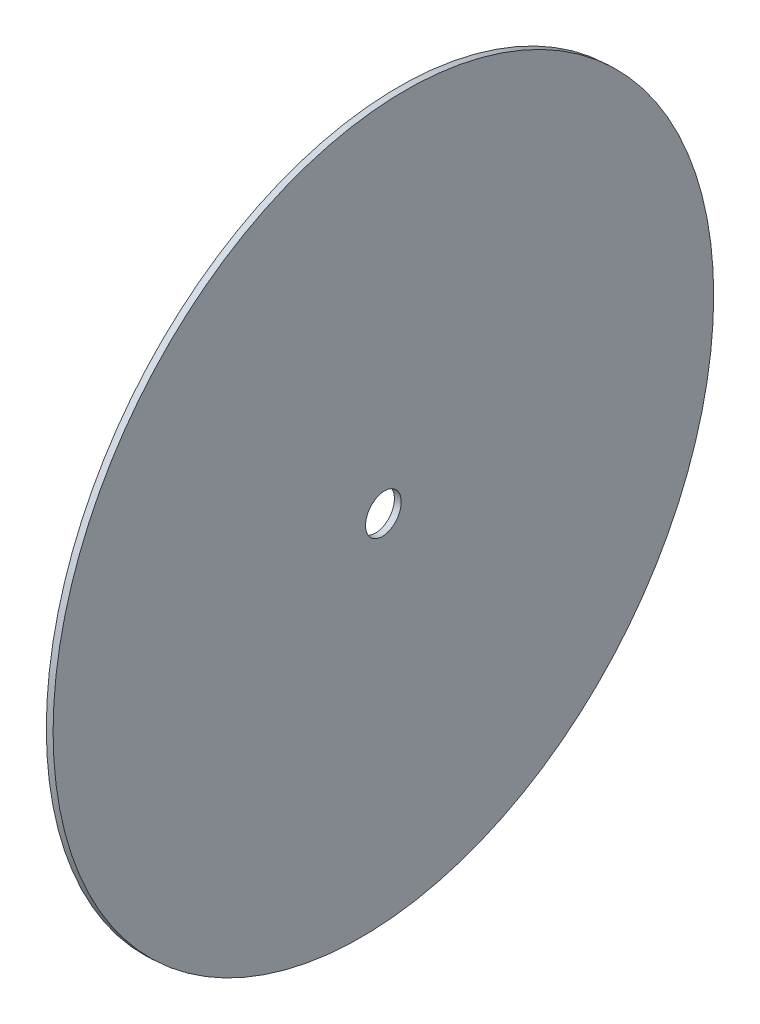
from build123d import *


with BuildPart() as part:
    # Esquisse1 → Révolution1 (revolve)
    with BuildSketch(Plane(origin=(0, 72.395438751, 0), x_dir=(-1, 0, 0), z_dir=(0, 1, 0))):
        Polygon((-79.724028307, 224.420067487), (-76.897447733, 182.41506252), (-76.099252864, 182.468774265), (-78.925833439, 224.473779232), align=None)
    revolve(axis=Axis((76.732714445, 72.395438751, 180.020720033), (-0.9977435859079075, 0, 0.06713968111057794)))


solid = part.part
